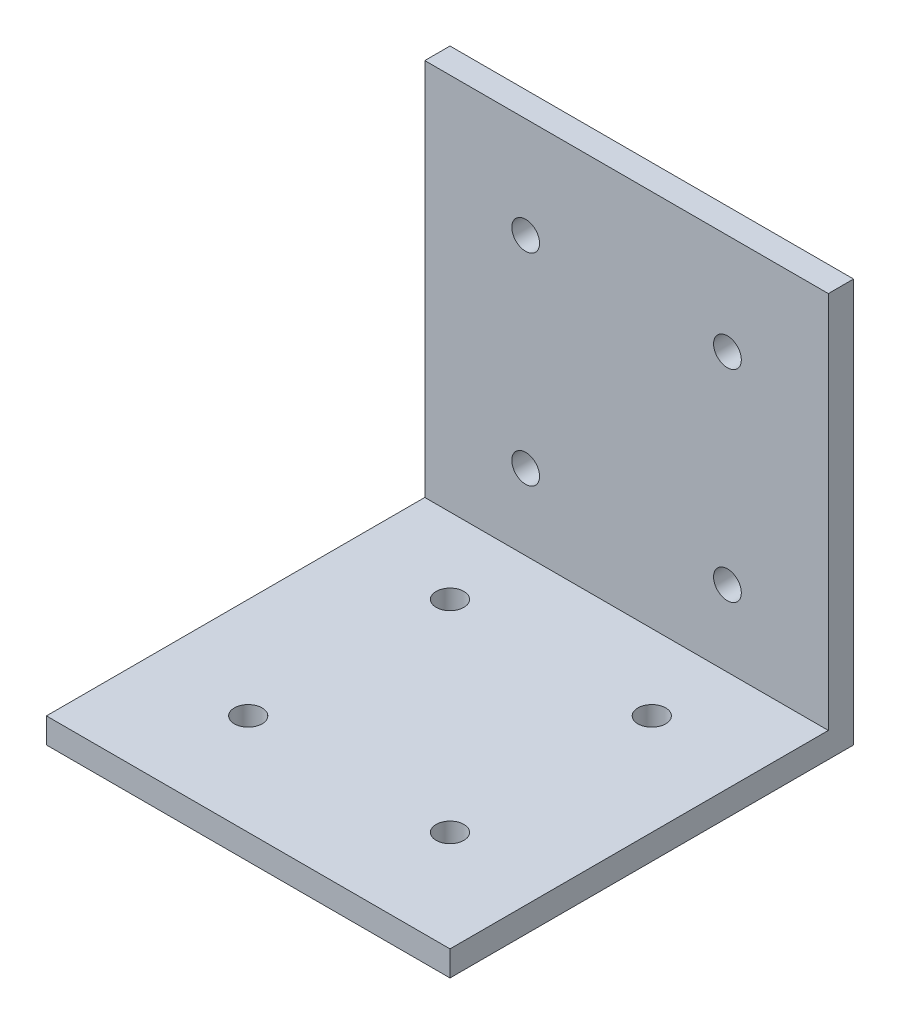
from build123d import *

# Parameters (mm, degrees)
SKETCH1_W           = 101.6
SKETCH1_H           = 101.6
SKETCH1_R           = 3.4925
BOSS_EXTRUDE1_DEPTH = 6.35
SKETCH2_W           = 101.6
SKETCH2_H           = 6.35
BOSS_EXTRUDE2_DEPTH = 95.25
SKETCH3_R           = 3.4925
CUT_EXTRUDE1_DEPTH  = 6.35


with BuildPart() as part:
    # Sketch1 → Boss-Extrude1 (new body)
    with BuildSketch(Plane(origin=(0, 0, 0), x_dir=(1, 0, 0), z_dir=(0, 1, 0))):
        Rectangle(SKETCH1_W, SKETCH1_H)
        with Locations(Location((-25.4, 25.4, 0), (0, 0, 270))):
            Circle(SKETCH1_R, mode=Mode.SUBTRACT)
        with Locations(Location((25.4, 25.4, 0), (0, 0, 270))):
            Circle(SKETCH1_R, mode=Mode.SUBTRACT)
        with Locations(Location((25.4, -25.4, 0), (0, 0, 270))):
            Circle(SKETCH1_R, mode=Mode.SUBTRACT)
        with Locations(Location((-25.4, -25.4, 0), (0, 0, 270))):
            Circle(SKETCH1_R, mode=Mode.SUBTRACT)
    extrude(amount=BOSS_EXTRUDE1_DEPTH)

    # Sketch2 → Boss-Extrude2 (add)
    with BuildSketch(Plane(origin=(0, 6.35, 0), x_dir=(1, 0, 0), z_dir=(0, 1, 0))):
        with Locations((0, 47.625)):
            Rectangle(SKETCH2_W, SKETCH2_H)
    extrude(amount=BOSS_EXTRUDE2_DEPTH)

    # Sketch3 → Cut-Extrude1 (cut)
    with BuildSketch(Plane(origin=(0, 0, -50.8), x_dir=(-1, 0, 0), z_dir=(0, 0, -1))):
        with Locations((-25.4, 76.2)):
            Circle(SKETCH3_R)
        with Locations((25.4, 76.2)):
            Circle(SKETCH3_R)
        with Locations((25.4, 25.4)):
            Circle(SKETCH3_R)
        with Locations((-25.4, 25.4)):
            Circle(SKETCH3_R)
    extrude(amount=-CUT_EXTRUDE1_DEPTH, mode=Mode.SUBTRACT)


solid = part.part
